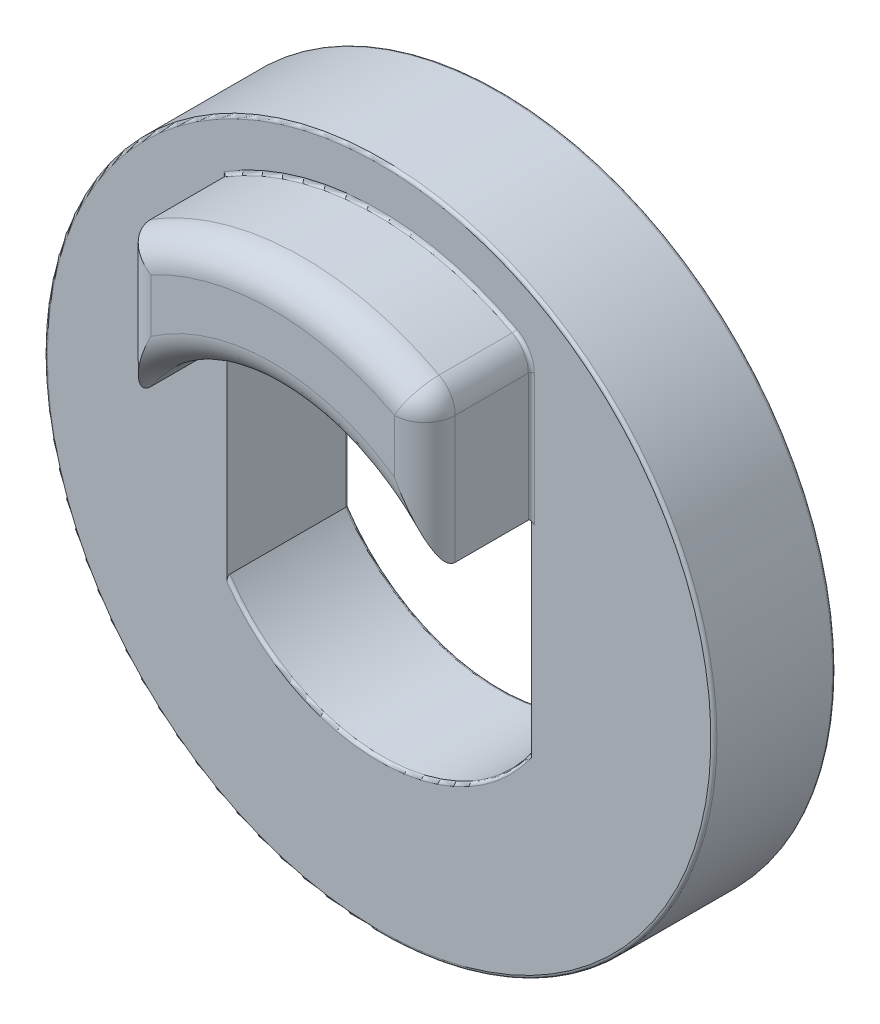
from build123d import *

# Parameters (mm, degrees)
SALIENTE_EXTRUIR1_DEPTH = 7.5
CORTAR_EXTRUIR1_DEPTH   = 3.5
REDONDEO1_R             = 1
REDONDEO2_R             = 0.1


with BuildPart() as part:
    # Croquis2 → Revolución1 (revolve)
    with BuildSketch(Plane(origin=(0, 0, 0), x_dir=(0, 0, -1), z_dir=(1, 0, 0)), mode=Mode.PRIVATE) as revoluci_n1_sk:
        Polygon((-7.5, 6), (0, 6), (0, 11), (-4, 11), (-4, 9.5), (-7.5, 9.5), align=None)
    revolve(revoluci_n1_sk.sketch.rotate(Axis((0, 0, 7.5), (0, 0, -1)), 90), axis=Axis((0, 0, 7.5), (0, 0, -1)))

    # Croquis3 → Saliente-Extruir1 (add, through all)
    with BuildSketch(Plane.XY.offset(7.5)):
        with BuildLine():
            ThreePointArc((6, 0), (5.744562647, 1.732050808), (5, 3.31662479))
            Line((5, 3.31662479), (5, -3.31662479))
            ThreePointArc((5, -3.31662479), (5.744562647, -1.732050808), (6, 0))
        make_face()
        with BuildLine():
            Line((-5, -3.31662479), (-5, 3.31662479))
            ThreePointArc((-5, 3.31662479), (-6, 0), (-5, -3.31662479))
        make_face()
    extrude(amount=-SALIENTE_EXTRUIR1_DEPTH)

    # Croquis4 → Cortar-Extruir1 (cut)
    with BuildSketch(Plane.XY.offset(7.5)):
        with BuildLine():
            ThreePointArc((9.5, 0), (8.299096336, 4.623310502), (5, 8.077747211))
            Line((5, 8.077747211), (5, 3.31662479))
            Line((5, 3.31662479), (5, -3.31662479))
            Line((5, -3.31662479), (5, -8.077747211))
            ThreePointArc((5, -8.077747211), (8.299096336, -4.623310502), (9.5, 0))
        make_face()
        with BuildLine():
            Line((-5, 3.31662479), (-5, 8.077747211))
            ThreePointArc((-5, 8.077747211), (-9.5, 0), (-5, -8.077747211))
            Line((-5, -8.077747211), (-5, -3.31662479))
            Line((-5, -3.31662479), (-5, 3.31662479))
        make_face()
        with BuildLine():
            Line((-5, -3.31662479), (-5, -8.077747211))
            Line((-5, -8.077747211), (5, -8.077747211))
            Line((5, -8.077747211), (5, -3.31662479))
            ThreePointArc((5, -3.31662479), (0, -6), (-5, -3.31662479))
        make_face()
        with BuildLine():
            Line((5, -8.077747211), (-5, -8.077747211))
            ThreePointArc((-5, -8.077747211), (0, -9.5), (5, -8.077747211))
        make_face()
    extrude(amount=-CORTAR_EXTRUIR1_DEPTH, mode=Mode.SUBTRACT)

    # Redondeo1
    redondeo1_edges = [part.edges().sort_by_distance(p)[0] for p in [
        (-5, 5.697186001, 7.5),
        (5, 5.697186001, 7.5),
        (5, 8.077747211, 5.75),
        (0, 6, 7.5),
        (0, 9.5, 7.5),
    ]]
    fillet(redondeo1_edges, radius=REDONDEO1_R)

    # Redondeo2
    redondeo2_edges = [part.edges().sort_by_distance(p)[0] for p in [
        (5, 0, 0),
        (0, -6, 0),
        (-5, 0, 0),
        (-5, 5.697186001, 4),
        (0, -6, 4),
        (0, 6, 0),
        (5, 5.408312395, 4),
        (-0.30539379, 9.495090028, 4),
        (4.857492926, 8.014495755, 4),
        (-11, 0, 4),
        (-11, 0, 0),
    ]]
    fillet(redondeo2_edges, radius=REDONDEO2_R)


solid = part.part
